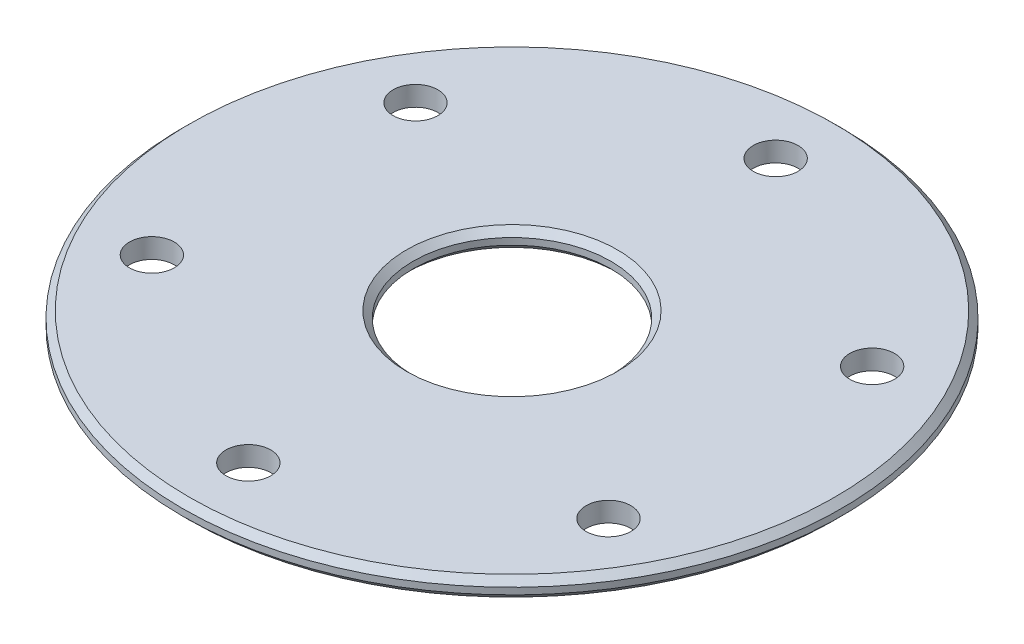
from build123d import *

# Parameters (mm, degrees)
SKETCH_1_R               = 50
EXTRUDE_1_DEPTH          = 3
PATTERN_CIRCULAR_1_COUNT = 6
SKETCH_7_R               = 15
CUT_EXTRUDE_1_DEPTH      = 3
CHAMFER_1_SIZE           = 1


with BuildPart() as part:
    # 草图1 → 凸台-拉伸1 (new body)
    with BuildSketch(Plane(origin=(0, 0, 0), x_dir=(1, 0, 0), z_dir=(0, 1, 0))):
        with Locations(Location((0, 0, 0), (0, 0, 270))):
            Circle(SKETCH_1_R)
    extrude(amount=EXTRUDE_1_DEPTH)

    # 草图6 → M8 螺纹孔的螺纹孔钻头1 (revolve, cut)
    with BuildSketch(Plane(origin=(0, 0, 40), x_dir=(0, 0, -1), z_dir=(1, 0, 0))):
        Polygon((0, 0), (0, 18.042926105), (3.4, 16), (3.4, 0), align=None)
    hole_wizard_m8_1 = revolve(axis=Axis((0, -6.35, 40), (0, 1, 0)), mode=Mode.SUBTRACT)

    # 阵列(圆周)1: M8 螺纹孔的螺纹孔钻头1 ×6 about axis
    pattern_circular_1_axis = Axis((0, 0, 0), (0, 1, 0))
    for i in range(1, PATTERN_CIRCULAR_1_COUNT):
        add(hole_wizard_m8_1.rotate(pattern_circular_1_axis, i * 360 / PATTERN_CIRCULAR_1_COUNT), mode=Mode.SUBTRACT)

    # 草图7 → 切除-拉伸1 (cut)
    with BuildSketch(Plane.XZ):
        with Locations(Location((0, 0, 0), (0, 0, 270))):
            Circle(SKETCH_7_R)
    extrude(amount=-CUT_EXTRUDE_1_DEPTH, mode=Mode.SUBTRACT)

    # 倒角1
    chamfer_1_edges = [part.edges().sort_by_distance(p)[0] for p in [
        (0, 0, -50),
        (0, 3, 15),
        (0, 0, 15),
        (0, 3, -50),
    ]]
    chamfer(chamfer_1_edges, length=CHAMFER_1_SIZE)


solid = part.part
